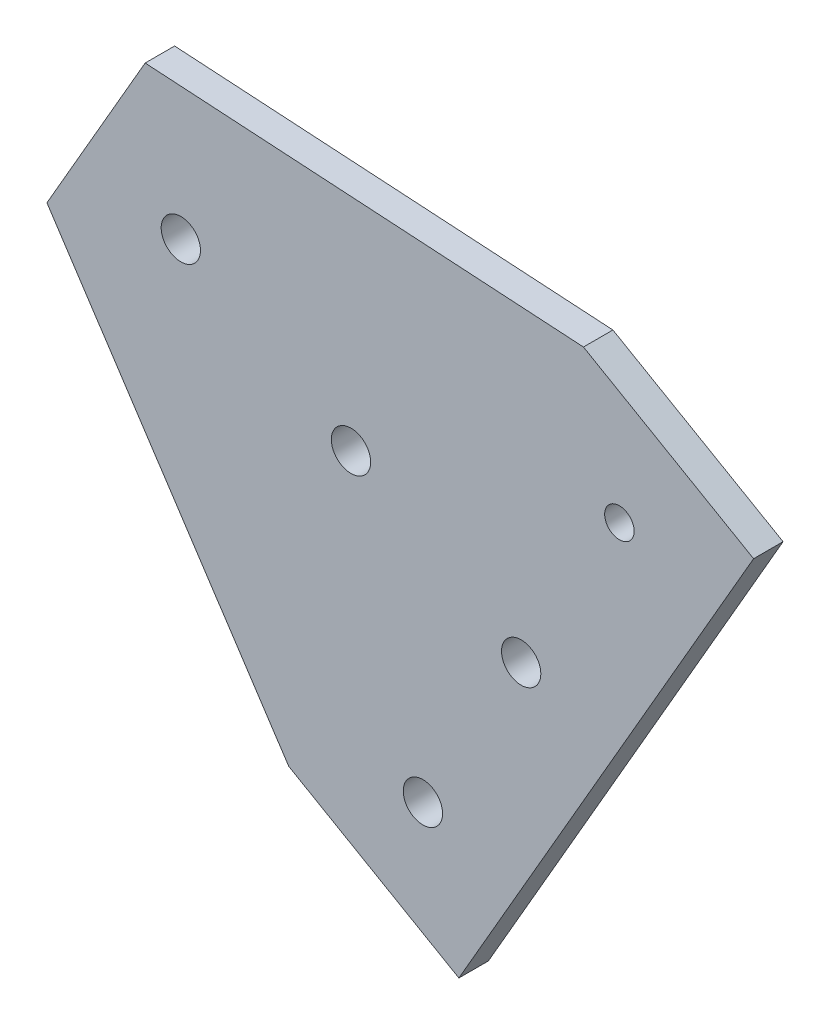
from build123d import *

# Parameters (mm, degrees)
SKETCH_1_R      = 2
SKETCH_1_R_2    = 1.5
EXTRUDE_1_DEPTH = 3


with BuildPart() as part:
    # 草图1 → 凸台-拉伸1 (new body)
    with BuildSketch(Plane.XY):
        Polygon((58.853165856, -49.318365271), (88.853165856, 2.643158956), (71.53265778, 12.643158956), (26.920763037, 15.371358588), (16.920763037, -1.949149488), (41.533407781, -39.318798283), align=None)
        with Locations((55.192911818, -35.658111233)):
            Circle(SKETCH_1_R, mode=Mode.SUBTRACT)
        with Locations((65.192911818, -18.337603157)):
            Circle(SKETCH_1_R, mode=Mode.SUBTRACT)
        with Locations((75.192911818, -1.017095081)):
            Circle(SKETCH_1_R_2, mode=Mode.SUBTRACT)
        with Locations((47.872403743, -8.337603157)):
            Circle(SKETCH_1_R, mode=Mode.SUBTRACT)
        with Locations((30.551895667, 1.662396843)):
            Circle(SKETCH_1_R, mode=Mode.SUBTRACT)
    extrude(amount=EXTRUDE_1_DEPTH)


solid = part.part
